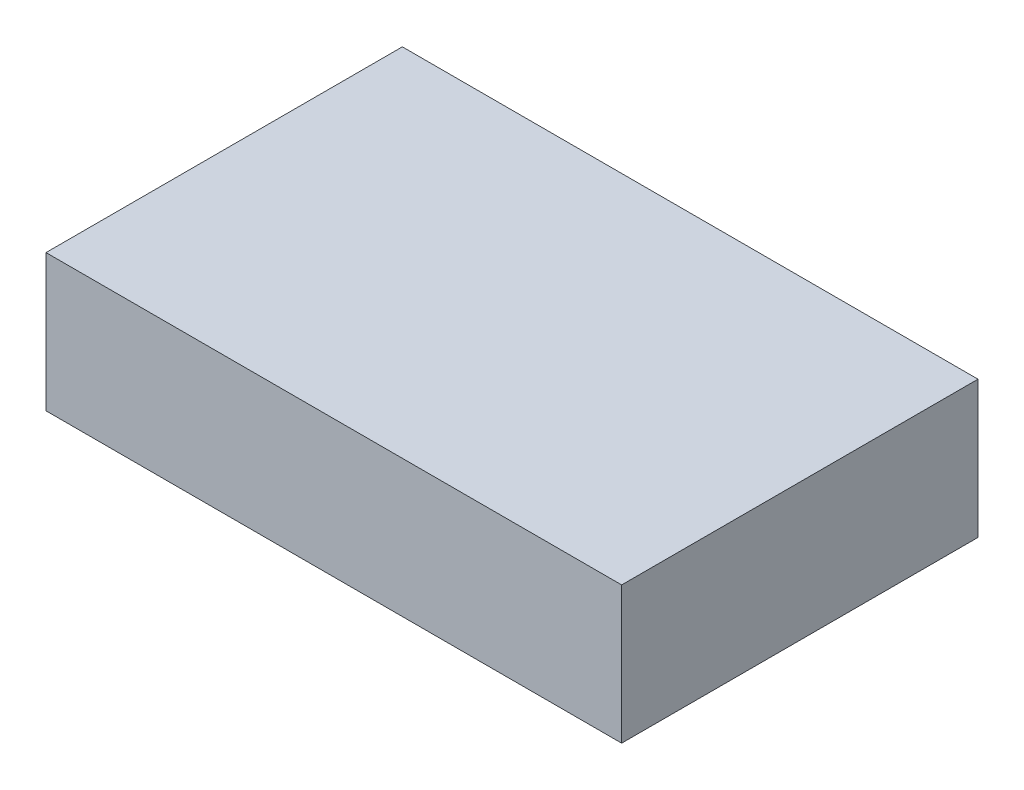
from build123d import *

# Parameters (mm, degrees)
SKETCH_1_W      = 42
SKETCH_1_H      = 26
EXTRUDE_1_DEPTH = 10


with BuildPart() as part:
    # 草图1 → 凸台-拉伸1 (new body)
    with BuildSketch(Plane(origin=(0, 0, 0), x_dir=(1, 0, 0), z_dir=(0, 1, 0))):
        Rectangle(SKETCH_1_W, SKETCH_1_H)
    extrude(amount=EXTRUDE_1_DEPTH)


solid = part.part
